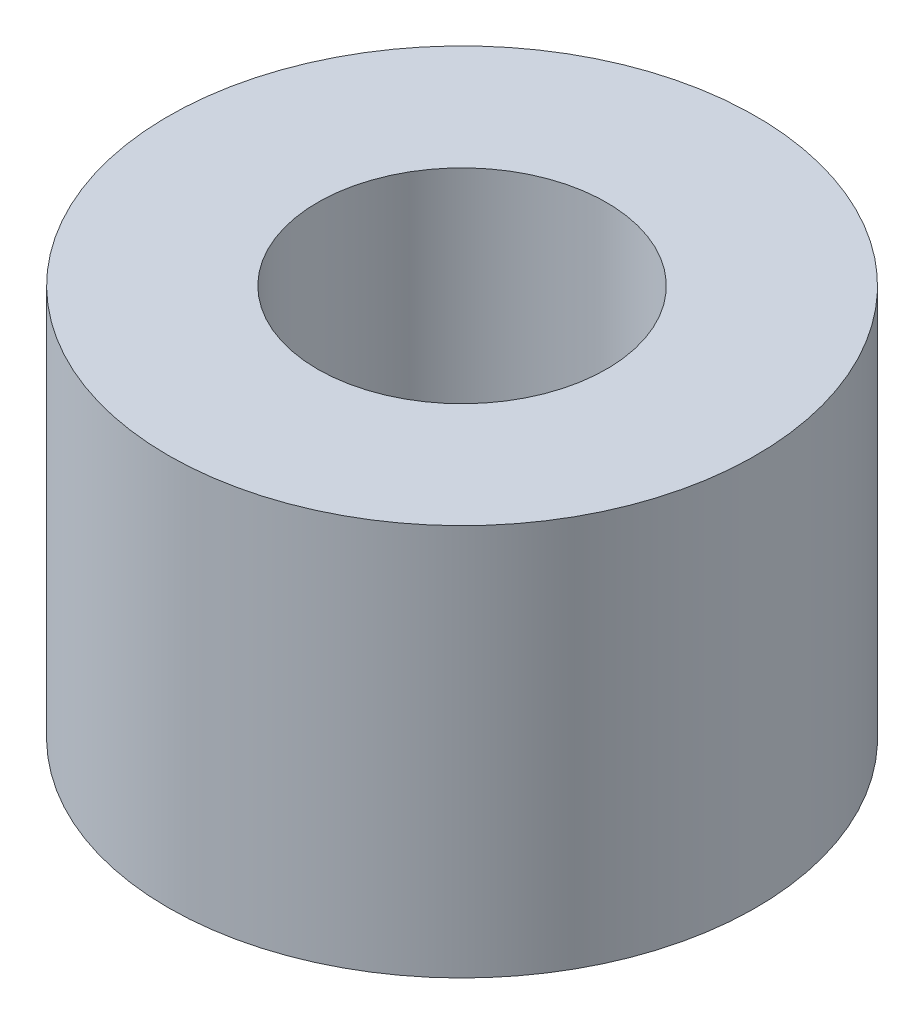
from build123d import *

# Parameters (mm, degrees)
SKETCH1_R           = 3
BOSS_EXTRUDE1_DEPTH = 4
SKETCH2_R           = 1.475
CUT_EXTRUDE1_DEPTH  = 6.830951895


with BuildPart() as part:
    # Sketch1 → Boss-Extrude1 (new body)
    with BuildSketch(Plane(origin=(0, 0, 0), x_dir=(1, 0, 0), z_dir=(0, 1, 0))):
        with Locations(Location((0, 0, 0), (0, 0, 270))):
            Circle(SKETCH1_R)
    extrude(amount=BOSS_EXTRUDE1_DEPTH)

    # Sketch2 → Cut-Extrude1 (cut, through all)
    with BuildSketch(Plane(origin=(0, 4, 0), x_dir=(1, 0, 0), z_dir=(0, 1, 0))):
        with Locations(Location((0, 0, 0), (0, 0, 270))):
            Circle(SKETCH2_R)
    extrude(amount=-CUT_EXTRUDE1_DEPTH, mode=Mode.SUBTRACT)


solid = part.part
